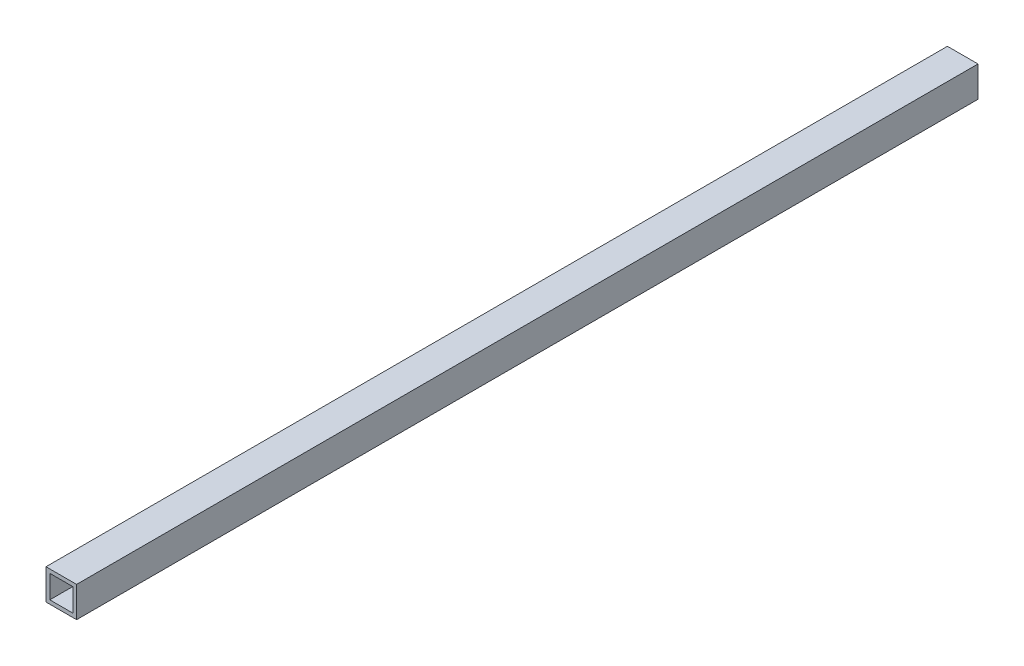
from build123d import *

# Parameters (mm, degrees)
SKETCH1_W           = 25.4
SKETCH1_H           = 748.388181024
BOSS_EXTRUDE1_DEPTH = 25.4
SKETCH2_W           = 19.05
SKETCH2_H           = 19.05
CUT_EXTRUDE1_DEPTH  = 750.249751082


with BuildPart() as part:
    # Sketch1 → Boss-Extrude1 (new body)
    with BuildSketch(Plane(origin=(0, 0, 0), x_dir=(1, 0, 0), z_dir=(0, 1, 0))):
        with Locations((-12.7, 0)):
            Rectangle(SKETCH1_W, SKETCH1_H)
    extrude(amount=BOSS_EXTRUDE1_DEPTH)

    # Sketch2 → Cut-Extrude1 (cut, through all)
    with BuildSketch(Plane.XY.offset(374.194090512)):
        with Locations((-12.7, 12.7)):
            Rectangle(SKETCH2_W, SKETCH2_H)
    extrude(amount=-CUT_EXTRUDE1_DEPTH, mode=Mode.SUBTRACT)


solid = part.part
